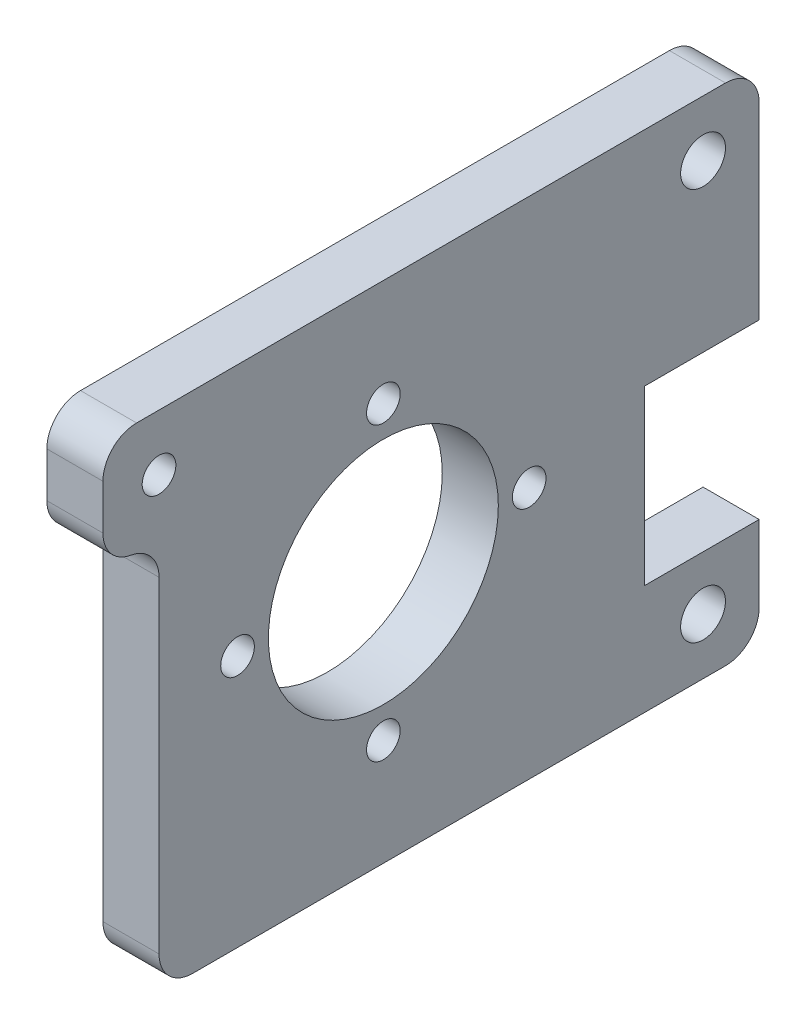
from build123d import *

# Parameters (mm, degrees)
SKETCH_1_W          = 53.5
SKETCH_1_H          = 45
SKETCH_1_R          = 10.25
SKETCH_1_R_2        = 2
SKETCH_1_R_3        = 1.5
EXTRUDE_1_DEPTH     = 5
SKETCH_3_W          = 5
SKETCH_3_H          = 10
EXTRUDE_2_DEPTH     = 5
SKETCH_4_R          = 1.5
SKETCH_4_W          = 10.4
SKETCH_4_H          = 15.4
CUT_EXTRUDE_2_DEPTH = 40.234073202
FILLET_1_R          = 3
FILLET_2_R          = 3


with BuildPart() as part:
    # ｽｹｯﾁ1 → ﾎﾞｽ - 押し出し1 (new body)
    with BuildSketch(Plane(origin=(0, 0, 0), x_dir=(0, 0, -1), z_dir=(1, 0, 0))):
        Rectangle(SKETCH_1_W, SKETCH_1_H)
        with Locations((-6.75, 0)):
            Circle(SKETCH_1_R, mode=Mode.SUBTRACT)
        with Locations((21.75, 17.5)):
            Circle(SKETCH_1_R_2, mode=Mode.SUBTRACT)
        with Locations(Location((21.75, -17.5, 0), (0, 0, 180))):
            Circle(SKETCH_1_R_2, mode=Mode.SUBTRACT)
        with Locations((6.25, 0)):
            Circle(SKETCH_1_R_3, mode=Mode.SUBTRACT)
        with Locations(Location((-19.75, 0, 0), (0, 0, 180))):
            Circle(SKETCH_1_R_3, mode=Mode.SUBTRACT)
        with Locations((-6.75, 13)):
            Circle(SKETCH_1_R_3, mode=Mode.SUBTRACT)
        with Locations(Location((-6.75, -13, 0), (0, 0, 180))):
            Circle(SKETCH_1_R_3, mode=Mode.SUBTRACT)
    extrude(amount=EXTRUDE_1_DEPTH)

    # ｽｹｯﾁ3 → ﾎﾞｽ - 押し出し2 (add)
    with BuildSketch(Plane(origin=(5, 0, 0), x_dir=(0, 0, -1), z_dir=(1, 0, 0))):
        with Locations((-29.25, 17.5)):
            Rectangle(SKETCH_3_W, SKETCH_3_H)
    extrude(amount=-EXTRUDE_2_DEPTH)

    # ｽｹｯﾁ4 → ｶｯﾄ - 押し出し2 (cut, through all)
    with BuildSketch(Plane(origin=(5, 0, 0), x_dir=(0, 0, -1), z_dir=(1, 0, 0))):
        with Locations((-26.75, 17.5)):
            Circle(SKETCH_4_R)
        with Locations((21.75, -5)):
            Rectangle(SKETCH_4_W, SKETCH_4_H)
    extrude(amount=-CUT_EXTRUDE_2_DEPTH, mode=Mode.SUBTRACT)

    # ﾌｨﾚｯﾄ1
    fillet_1_edges = [part.edges().sort_by_distance(p)[0] for p in [
        (2.5, 22.5, 31.75),
        (2.5, 12.5, 31.75),
        (2.5, -22.5, -26.75),
        (2.5, -22.5, 26.75),
        (2.5, 22.5, -26.75),
    ]]
    fillet(fillet_1_edges, radius=FILLET_1_R)

    # ﾌｨﾚｯﾄ2
    fillet_2_edges = [part.edges().sort_by_distance(p)[0] for p in [
        (2.5, 12.5, 26.75),
    ]]
    fillet(fillet_2_edges, radius=FILLET_2_R)


solid = part.part
